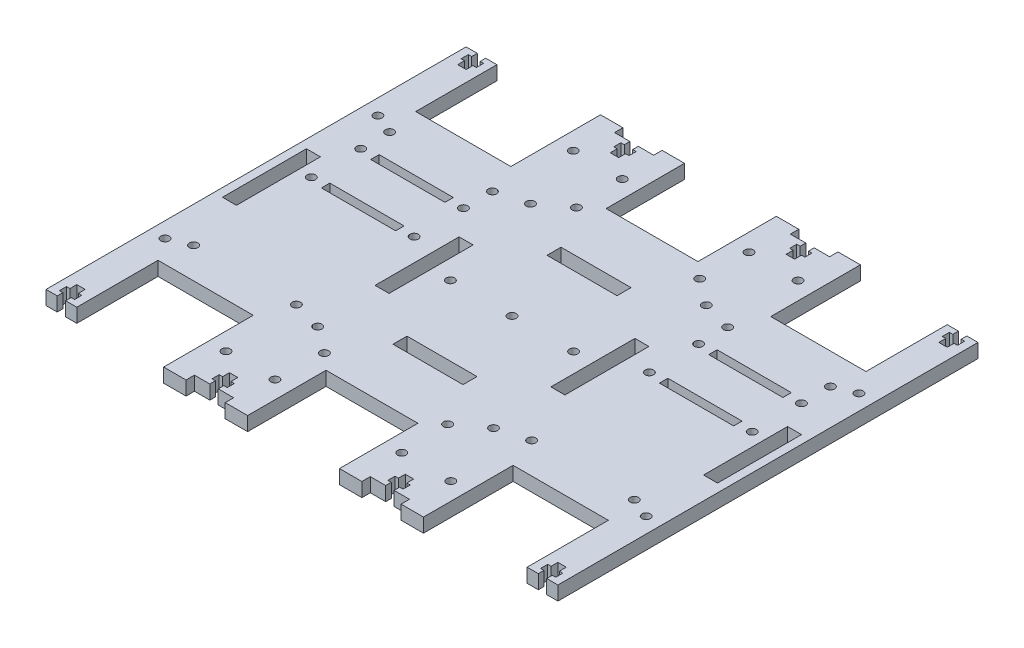
from build123d import *

# Parameters (mm, degrees)
SKETCH1_W             = 11
SKETCH1_H             = 5
BOSS_EXTRUDE1_DEPTH   = 25
SKETCH1_W_2           = 30
BOSS_EXTRUDE1_2_DEPTH = 25
BOSS_EXTRUDE1_3_DEPTH = 25
BOSS_EXTRUDE1_4_DEPTH = 25
SKETCH2_W             = 182.788084332
SKETCH2_H             = 5
BOSS_EXTRUDE4_DEPTH   = 100
SKETCH3_W             = 30
SKETCH3_H             = 5
SKETCH3_W_2           = 11
BOSS_EXTRUDE5_DEPTH   = 25
CUT_EXTRUDE1_DEPTH    = 176.721003137
SKETCH5_W             = 8
SKETCH5_H             = 5
BOSS_EXTRUDE6_DEPTH   = 3
SKETCH6_W             = 8
SKETCH6_H             = 5
BOSS_EXTRUDE7_DEPTH   = 3
SKETCH7_W             = 5
SKETCH7_H             = 30
CUT_EXTRUDE2_DEPTH    = 179.288729154
SKETCH8_R             = 1.5
CUT_EXTRUDE3_DEPTH    = 179.288729154
SKETCH9_R             = 1.5
SKETCH9_W             = 5
SKETCH9_H             = 30
CUT_EXTRUDE4_DEPTH    = 179.288729154
SKETCH10_W            = 34
SKETCH10_H            = 5
CUT_EXTRUDE5_DEPTH    = 5
SKETCH11_W            = 25
SKETCH11_H            = 5
CUT_EXTRUDE6_DEPTH    = 179.288729154
SKETCH12_R            = 1.5
SKETCH12_W            = 26.5
SKETCH12_H            = 3
CUT_EXTRUDE7_DEPTH    = 179.288729154
SKETCH14_R            = 1.5
CUT_EXTRUDE8_DEPTH    = 179.288729154
SKETCH15_R            = 1.5
CUT_EXTRUDE9_DEPTH    = 179.288729154


with BuildPart() as part:
    # Sketch1 → Boss-Extrude1 (new body)
    with BuildSketch(Plane.XY):
        with Locations((-85.894042166, 59.58544814)):
            Rectangle(SKETCH1_W, SKETCH1_H)
    extrude(amount=BOSS_EXTRUDE1_DEPTH)



with BuildPart() as body_2:
    # Sketch1 → Boss-Extrude1 2 (new body)
    with BuildSketch(Plane.XY):
        with Locations((-31.394042166, 59.58544814)):
            Rectangle(SKETCH1_W_2, SKETCH1_H)
    extrude(amount=BOSS_EXTRUDE1_2_DEPTH)


with BuildPart() as body_3:
    # Sketch1 → Boss-Extrude1 3 (new body)
    with BuildSketch(Plane.XY):
        with Locations((31.394042166, 59.58544814)):
            Rectangle(SKETCH1_W_2, SKETCH1_H)
    extrude(amount=BOSS_EXTRUDE1_3_DEPTH)


with BuildPart() as body_4:
    # Sketch1 → Boss-Extrude1 4 (new body)
    with BuildSketch(Plane.XY):
        with Locations((85.894042166, 59.58544814)):
            Rectangle(SKETCH1_W, SKETCH1_H)
    extrude(amount=BOSS_EXTRUDE1_4_DEPTH)


with BuildPart() as part_1:
    add(part.part)

    add(body_2.part)  # Boss-Extrude4 merges body 2

    add(body_3.part)  # Boss-Extrude4 merges body 3

    add(body_4.part)  # Boss-Extrude4 merges body 4
    # Sketch2 → Boss-Extrude4 (add)
    with BuildSketch(Plane.XY.offset(25)):
        with Locations((0, 59.58544814)):
            Rectangle(SKETCH2_W, SKETCH2_H)
    extrude(amount=BOSS_EXTRUDE4_DEPTH)

    # Sketch3 → Boss-Extrude5 (add)
    with BuildSketch(Plane.XY.offset(125)):
        with Locations((31.394042166, 59.58544814)):
            Rectangle(SKETCH3_W, SKETCH3_H)
        with Locations((-31.394042166, 59.58544814)):
            Rectangle(SKETCH3_W, SKETCH3_H)
        with Locations((-85.894042166, 59.58544814)):
            Rectangle(SKETCH3_W_2, SKETCH3_H)
        with Locations((85.894042166, 59.58544814)):
            Rectangle(SKETCH3_W_2, SKETCH3_H)
    extrude(amount=BOSS_EXTRUDE5_DEPTH)

    # Sketch4 → Cut-Extrude1 (cut, through all)
    with BuildSketch(Plane(origin=(0, 62.08544814, 0), x_dir=(1, 0, 0), z_dir=(0, 1, 0))):
        Polygon((84.394042166, -2), (83.169042166, -2), (83.169042166, -4.55), (84.394042166, -4.55), (84.394042166, -7), (87.394042166, -7), (87.394042166, -4.55), (88.619042166, -4.55), (88.619042166, -2), (87.394042166, -2), (87.394042166, 0), (84.394042166, 0), align=None)
        Polygon((29.894042166, -2), (29.894042166, 0), (32.894042166, 0), (32.894042166, -2), (34.119042166, -2), (34.119042166, -4.55), (32.894042166, -4.55), (32.894042166, -7), (29.894042166, -7), (29.894042166, -4.55), (28.669042166, -4.55), (28.669042166, -2), align=None)
        Polygon((-87.394042166, -2), (-87.394042166, 0), (-84.394042166, 0), (-84.394042166, -2), (-83.169042166, -2), (-83.169042166, -4.55), (-84.394042166, -4.55), (-84.394042166, -7), (-87.394042166, -7), (-87.394042166, -4.55), (-88.619042166, -4.55), (-88.619042166, -2), align=None)
        Polygon((-32.894042166, -2), (-34.119042166, -2), (-34.119042166, -4.55), (-32.894042166, -4.55), (-32.894042166, -7), (-29.894042166, -7), (-29.894042166, -4.55), (-28.669042166, -4.55), (-28.669042166, -2), (-29.894042166, -2), (-29.894042166, 0), (-32.894042166, 0), align=None)
        Polygon((-29.894042166, -148), (-29.894042166, -150), (-32.894042166, -150), (-32.894042166, -148), (-34.119042166, -148), (-34.119042166, -145.45), (-32.894042166, -145.45), (-32.894042166, -143), (-29.894042166, -143), (-29.894042166, -145.45), (-28.669042166, -145.45), (-28.669042166, -148), align=None)
        Polygon((-84.394042166, -148), (-83.169042166, -148), (-83.169042166, -145.45), (-84.394042166, -145.45), (-84.394042166, -143), (-87.394042166, -143), (-87.394042166, -145.45), (-88.619042166, -145.45), (-88.619042166, -148), (-87.394042166, -148), (-87.394042166, -150), (-84.394042166, -150), align=None)
        Polygon((32.894042166, -148), (34.119042166, -148), (34.119042166, -145.45), (32.894042166, -145.45), (32.894042166, -143), (29.894042166, -143), (29.894042166, -145.45), (28.669042166, -145.45), (28.669042166, -148), (29.894042166, -148), (29.894042166, -150), (32.894042166, -150), align=None)
        Polygon((87.394042166, -148), (87.394042166, -150), (84.394042166, -150), (84.394042166, -148), (83.169042166, -148), (83.169042166, -145.45), (84.394042166, -145.45), (84.394042166, -143), (87.394042166, -143), (87.394042166, -145.45), (88.619042166, -145.45), (88.619042166, -148), align=None)
    extrude(amount=-CUT_EXTRUDE1_DEPTH, mode=Mode.SUBTRACT)

    # Sketch5 → Boss-Extrude6 (add)
    with BuildSketch(Plane(origin=(0, 0, 0), x_dir=(-1, 0, 0), z_dir=(0, 0, -1))):
        with Locations((-42.394042166, 59.58544814)):
            Rectangle(SKETCH5_W, SKETCH5_H)
        with Locations((-20.394042166, 59.58544814)):
            Rectangle(SKETCH5_W, SKETCH5_H)
        with Locations((20.394042166, 59.58544814)):
            Rectangle(SKETCH5_W, SKETCH5_H)
        with Locations((42.394042166, 59.58544814)):
            Rectangle(SKETCH5_W, SKETCH5_H)
    extrude(amount=BOSS_EXTRUDE6_DEPTH)

    # Sketch6 → Boss-Extrude7 (add)
    with BuildSketch(Plane.XY.offset(150)):
        with Locations((-20.394042166, 59.58544814)):
            Rectangle(SKETCH6_W, SKETCH6_H)
        with Locations((20.394042166, 59.58544814)):
            Rectangle(SKETCH6_W, SKETCH6_H)
        with Locations((42.394042166, 59.58544814)):
            Rectangle(SKETCH6_W, SKETCH6_H)
        with Locations((-42.394042166, 59.58544814)):
            Rectangle(SKETCH6_W, SKETCH6_H)
    extrude(amount=BOSS_EXTRUDE7_DEPTH)

    # Sketch7 → Cut-Extrude2 (cut, through all)
    with BuildSketch(Plane(origin=(0, 62.08544814, 0), x_dir=(1, 0, 0), z_dir=(0, 1, 0))):
        with Locations((85.894042166, -75)):
            Rectangle(SKETCH7_W, SKETCH7_H)
        with Locations((-85.894042166, -75)):
            Rectangle(SKETCH7_W, SKETCH7_H)
    extrude(amount=-CUT_EXTRUDE2_DEPTH, mode=Mode.SUBTRACT)

    # Sketch8 → Cut-Extrude3 (cut, through all)
    with BuildSketch(Plane(origin=(0, 62.08544814, 0), x_dir=(1, 0, 0), z_dir=(0, 1, 0))):
        with Locations(Location((-85.894042166, -37, 0), (0, 0, 270))):
            Circle(SKETCH8_R)
        with Locations(Location((-85.894042166, -113, 0), (0, 0, 90))):
            Circle(SKETCH8_R)
        with Locations(Location((85.894042166, -113, 0), (0, 0, 270))):
            Circle(SKETCH8_R)
        with Locations(Location((85.894042166, -37, 0), (0, 0, 90))):
            Circle(SKETCH8_R)
    extrude(amount=-CUT_EXTRUDE3_DEPTH, mode=Mode.SUBTRACT)

    # Sketch9 → Cut-Extrude4 (cut, through all)
    with BuildSketch(Plane(origin=(0, 62.08544814, 0), x_dir=(1, 0, 0), z_dir=(0, 1, 0))):
        with Locations(Location((-31.394042166, -37, 0), (0, 0, 90))):
            Circle(SKETCH9_R)
        with Locations(Location((-31.394042166, -113, 0), (0, 0, 270))):
            Circle(SKETCH9_R)
        with Locations(Location((31.394042166, -113, 0), (0, 0, 90))):
            Circle(SKETCH9_R)
        with Locations(Location((31.394042166, -37, 0), (0, 0, 270))):
            Circle(SKETCH9_R)
        with Locations((-31.394042166, -75)):
            Rectangle(SKETCH9_W, SKETCH9_H)
        with Locations((31.394042166, -75)):
            Rectangle(SKETCH9_W, SKETCH9_H)
    extrude(amount=-CUT_EXTRUDE4_DEPTH, mode=Mode.SUBTRACT)

    # Sketch10 → Cut-Extrude5 (cut)
    with BuildSketch(Plane(origin=(0, 62.08544814, 0), x_dir=(1, 0, 0), z_dir=(0, 1, 0))):
        with Locations((63.394042166, -26.5)):
            Rectangle(SKETCH10_W, SKETCH10_H)
        with Locations((63.394042166, -123.5)):
            Rectangle(SKETCH10_W, SKETCH10_H)
        with Locations((-63.394042166, -26.5)):
            Rectangle(SKETCH10_W, SKETCH10_H)
        with Locations((-63.394042166, -123.5)):
            Rectangle(SKETCH10_W, SKETCH10_H)
    extrude(amount=-CUT_EXTRUDE5_DEPTH, mode=Mode.SUBTRACT)

    # Sketch11 → Cut-Extrude6 (cut, through all)
    with BuildSketch(Plane(origin=(0, 62.08544814, 0), x_dir=(1, 0, 0), z_dir=(0, 1, 0))):
        with Locations((0, -47.5)):
            Rectangle(SKETCH11_W, SKETCH11_H)
        with Locations((0, -102.5)):
            Rectangle(SKETCH11_W, SKETCH11_H)
    extrude(amount=-CUT_EXTRUDE6_DEPTH, mode=Mode.SUBTRACT)

    # Sketch12 → Cut-Extrude7 (cut, through all)
    with BuildSketch(Plane(origin=(0, 62.08544814, 0), x_dir=(1, 0, 0), z_dir=(0, 1, 0))):
        with Locations(Location((-41.994042166, -67.95, 0), (0, 0, 270))):
            Circle(SKETCH12_R)
        with Locations(Location((-78.694042166, -67.95, 0), (0, 0, 270))):
            Circle(SKETCH12_R)
        with Locations(Location((-78.694042166, -50.35, 0), (0, 0, 90))):
            Circle(SKETCH12_R)
        with Locations(Location((-41.994042166, -50.35, 0), (0, 0, 90))):
            Circle(SKETCH12_R)
        with Locations(Location((41.994042166, -67.95, 0), (0, 0, 90))):
            Circle(SKETCH12_R)
        with Locations(Location((78.694042166, -67.95, 0), (0, 0, 90))):
            Circle(SKETCH12_R)
        with Locations(Location((41.994042166, -50.35, 0), (0, 0, 270))):
            Circle(SKETCH12_R)
        with Locations(Location((78.694042166, -50.35, 0), (0, 0, 270))):
            Circle(SKETCH12_R)
        with Locations((60.344042166, -50.35)):
            Rectangle(SKETCH12_W, SKETCH12_H)
        with Locations((-60.344042166, -67.95)):
            Rectangle(SKETCH12_W, SKETCH12_H)
        with Locations((-60.344042166, -50.35)):
            Rectangle(SKETCH12_W, SKETCH12_H)
        with Locations((60.344042166, -67.95)):
            Rectangle(SKETCH12_W, SKETCH12_H)
    extrude(amount=-CUT_EXTRUDE7_DEPTH, mode=Mode.SUBTRACT)

    # Sketch14 → Cut-Extrude8 (cut, through all)
    with BuildSketch(Plane.XZ.offset(-57.08544814)):
        with Locations(Location((0, 75, 0), (0, 0, 270))):
            Circle(SKETCH14_R)
        with Locations(Location((-22, 75, 0), (0, 0, 270))):
            Circle(SKETCH14_R)
        with Locations(Location((-22, 30, 0), (0, 0, 270))):
            Circle(SKETCH14_R)
        with Locations(Location((22, 75, 0), (0, 0, 90))):
            Circle(SKETCH14_R)
        with Locations(Location((22, 30, 0), (0, 0, 90))):
            Circle(SKETCH14_R)
        with Locations(Location((-22, 120, 0), (0, 0, 90))):
            Circle(SKETCH14_R)
        with Locations(Location((22, 120, 0), (0, 0, 270))):
            Circle(SKETCH14_R)
        with Locations(Location((41.994042166, 40, 0), (0, 0, 270))):
            Circle(SKETCH14_R)
        with Locations(Location((78.694042166, 40, 0), (0, 0, 270))):
            Circle(SKETCH14_R)
        with Locations(Location((41.994042166, 110, 0), (0, 0, 90))):
            Circle(SKETCH14_R)
        with Locations(Location((78.694042166, 110, 0), (0, 0, 90))):
            Circle(SKETCH14_R)
        with Locations(Location((-41.994042166, 110, 0), (0, 0, 270))):
            Circle(SKETCH14_R)
        with Locations(Location((-78.694042166, 110, 0), (0, 0, 270))):
            Circle(SKETCH14_R)
        with Locations(Location((-41.994042166, 40, 0), (0, 0, 90))):
            Circle(SKETCH14_R)
        with Locations(Location((-78.694042166, 40, 0), (0, 0, 90))):
            Circle(SKETCH14_R)
    extrude(amount=-CUT_EXTRUDE8_DEPTH, mode=Mode.SUBTRACT)

    # Sketch15 → Cut-Extrude9 (cut, through all)
    with BuildSketch(Plane.XZ.offset(-57.08544814)):
        with Locations(Location((40.144042166, 13, 0), (0, 0, 270))):
            Circle(SKETCH15_R)
        with Locations(Location((22.644042166, 13, 0), (0, 0, 90))):
            Circle(SKETCH15_R)
        with Locations(Location((-22.644042166, 13, 0), (0, 0, 270))):
            Circle(SKETCH15_R)
        with Locations(Location((-40.144042166, 13, 0), (0, 0, 90))):
            Circle(SKETCH15_R)
        with Locations(Location((-40.144042166, 137, 0), (0, 0, 270))):
            Circle(SKETCH15_R)
        with Locations(Location((-22.644042166, 137, 0), (0, 0, 90))):
            Circle(SKETCH15_R)
        with Locations(Location((22.644042166, 137, 0), (0, 0, 270))):
            Circle(SKETCH15_R)
        with Locations(Location((40.144042166, 137, 0), (0, 0, 90))):
            Circle(SKETCH15_R)
    extrude(amount=-CUT_EXTRUDE9_DEPTH, mode=Mode.SUBTRACT)


solid = part_1.part
